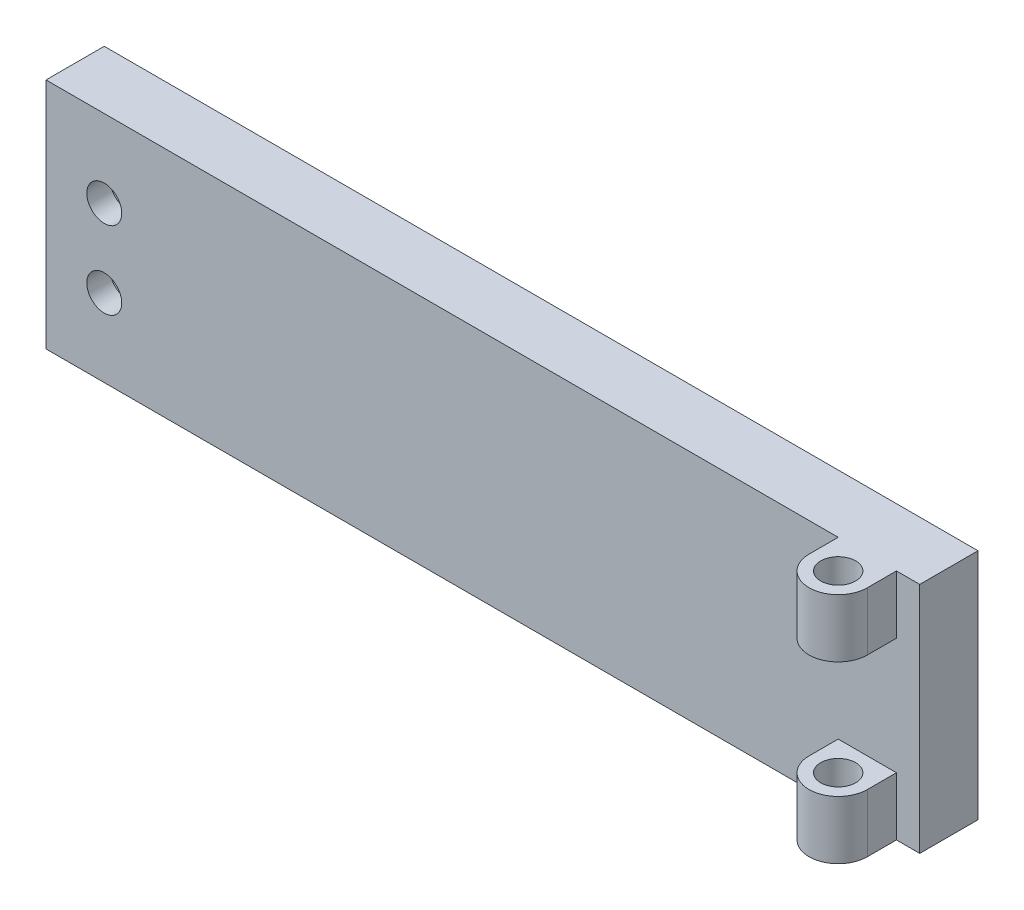
from build123d import *

# Parameters (mm, degrees)
ESQUISSE1_W             = 75
ESQUISSE1_H             = 20
BOSS_EXTRU_1_DEPTH      = 5
ESQUISSE2_W             = 5
ESQUISSE2_H             = 5
BOSS_EXTRU_2_DEPTH      = 5
ESQUISSE3_R             = 1.5
ENL_V_MAT_EXTRU_1_DEPTH = 79.262379212
ESQUISSE4_R             = 1.5
ENL_V_MAT_EXTRU_2_DEPTH = 79.262379212
ESQUISSE5_R             = 3
ENL_V_MAT_EXTRU_3_DEPTH = 3


with BuildPart() as part:
    # Esquisse1 → Boss.-Extru.1 (new body)
    with BuildSketch(Plane.XY):
        with Locations((37.5, 10)):
            Rectangle(ESQUISSE1_W, ESQUISSE1_H)
    extrude(amount=BOSS_EXTRU_1_DEPTH)

    # Esquisse2 → Boss.-Extru.2 (add)
    with BuildSketch(Plane.XY.offset(5)):
        with Locations((70.5, 17.5)):
            Rectangle(ESQUISSE2_W, ESQUISSE2_H)
        with Locations((70.5, 2.5)):
            Rectangle(ESQUISSE2_W, ESQUISSE2_H)
    extrude(amount=BOSS_EXTRU_2_DEPTH)

    # Esquisse3 → Enlèv. mat.-Extru.1 (cut, through all)
    with BuildSketch(Plane.XZ):
        with Locations(Location((70.5, 7.5, 0), (0, 0, 270))):
            Circle(ESQUISSE3_R)
        with BuildLine():
            Line((68, 10), (68, 7.5))
            ThreePointArc((68, 7.5), (68.732233047, 9.267766953), (70.5, 10))
            Line((70.5, 10), (68, 10))
        make_face()
        with BuildLine():
            Line((73, 10), (70.5, 10))
            ThreePointArc((70.5, 10), (72.267766953, 9.267766953), (73, 7.5))
            Line((73, 7.5), (73, 10))
        make_face()
    extrude(amount=-ENL_V_MAT_EXTRU_1_DEPTH, mode=Mode.SUBTRACT)

    # Esquisse4 → Enlèv. mat.-Extru.2 (cut, through all)
    with BuildSketch(Plane(origin=(0, 0, 0), x_dir=(-1, 0, 0), z_dir=(0, 0, -1))):
        with Locations((-5, 6.666666667)):
            Circle(ESQUISSE4_R)
        with Locations((-5, 13.333333333)):
            Circle(ESQUISSE4_R)
    extrude(amount=-ENL_V_MAT_EXTRU_2_DEPTH, mode=Mode.SUBTRACT)

    # Esquisse5 → Enlèv. mat.-Extru.3 (cut)
    with BuildSketch(Plane(origin=(0, 0, 0), x_dir=(-1, 0, 0), z_dir=(0, 0, -1))):
        with Locations((-5, 6.666666667)):
            Circle(ESQUISSE5_R)
        with Locations((-5, 13.333333333)):
            Circle(ESQUISSE5_R)
    extrude(amount=-ENL_V_MAT_EXTRU_3_DEPTH, mode=Mode.SUBTRACT)


solid = part.part
